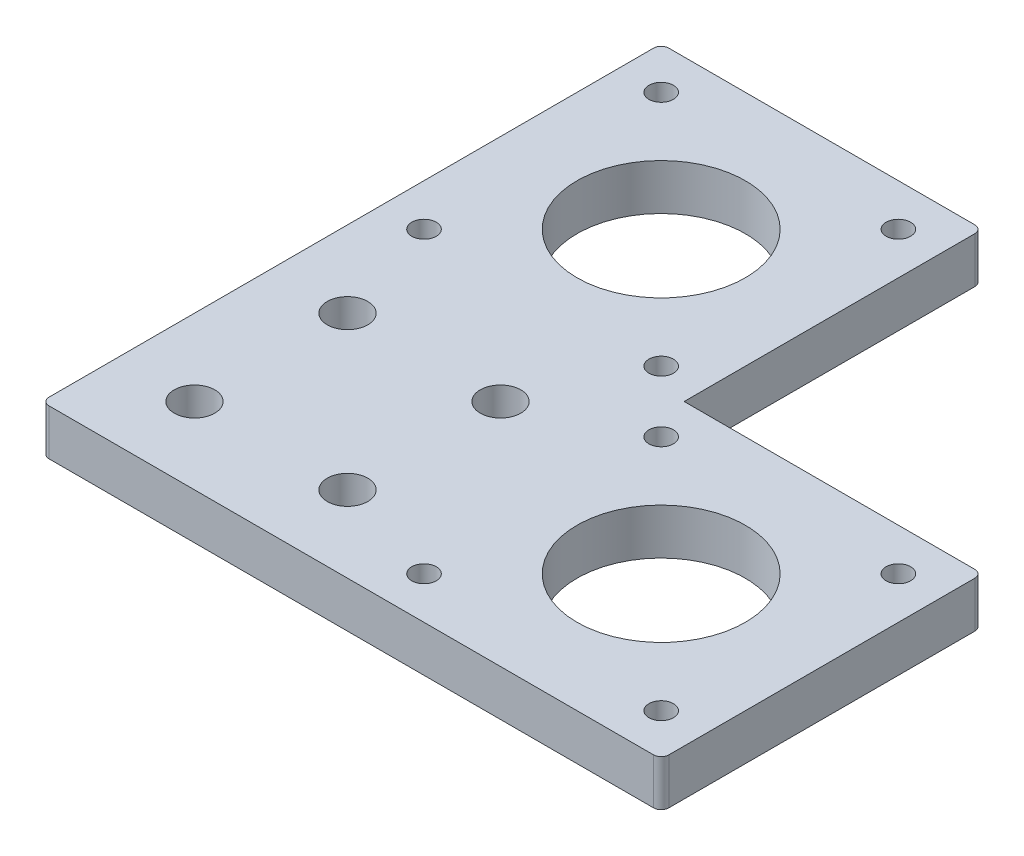
from build123d import *

# Parameters (mm, degrees)
BOSS_EXTRUDE1_DEPTH        = 6
M5_CLEARANCE_HOLE1_D       = 5.3
M3_CLEARANCE_HOLE1_D       = 3.2
F_22_0_22_DIAMETER_HOLE1_D = 22
FILLET1_R                  = 1


with BuildPart() as part:
    # Sketch1 → Boss-Extrude1 (new body)
    with BuildSketch(Plane(origin=(0, 0, 0), x_dir=(1, 0, 0), z_dir=(0, 1, 0))):
        Polygon((0, 0), (81, 0), (81, 42), (42, 42), (42, 81), (0, 81), align=None)
    extrude(amount=BOSS_EXTRUDE1_DEPTH)

    # M5 Clearance Hole1 (through all)
    with Locations(Plane(origin=(0, 6, 0), x_dir=(1, 0, 0), z_dir=(0, 1, 0))):
        with Locations((10, 30), (30, 30), (30, 10), (10, 10)):
            Hole(M5_CLEARANCE_HOLE1_D / 2)

    # M3 Clearance Hole1 (through all)
    with Locations(Plane(origin=(0, 6, 0), x_dir=(1, 0, 0), z_dir=(0, 1, 0))):
        with Locations((5.5, 44.5), (36.5, 44.5), (36.5, 75.5), (5.5, 75.5), (44.5, 36.5), (44.5, 5.5), (75.5, 5.5), (75.5, 36.5)):
            Hole(M3_CLEARANCE_HOLE1_D / 2)

    # Ø22.0 (22) Diameter Hole1 (through all)
    with Locations(Plane(origin=(0, 6, 0), x_dir=(1, 0, 0), z_dir=(0, 1, 0))):
        with Locations((60, 21), (21, 60)):
            Hole(F_22_0_22_DIAMETER_HOLE1_D / 2)

    # Fillet1
    fillet1_edges = [part.edges().sort_by_distance(p)[0] for p in [
        (0, 3, -81),
        (42, 3, -81),
        (81, 3, -42),
        (81, 3, 0),
        (0, 3, 0),
    ]]
    fillet(fillet1_edges, radius=FILLET1_R)


solid = part.part
